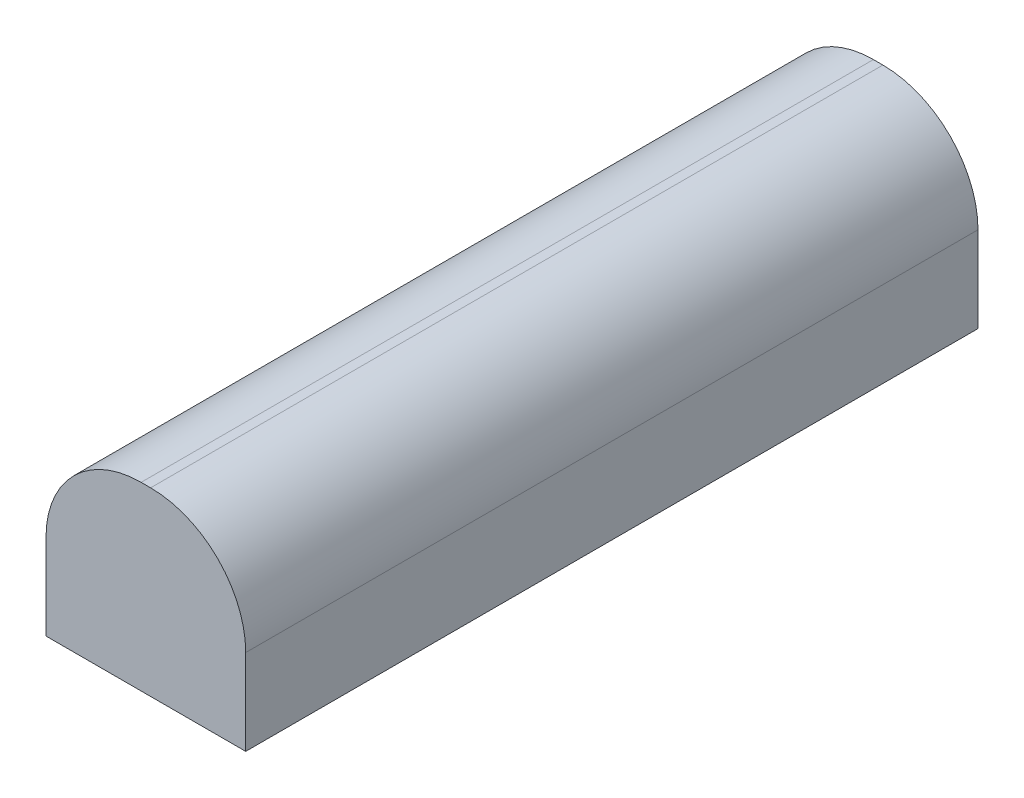
from build123d import *

# Parameters (mm, degrees)
SKETCH1_W           = 21
SKETCH1_H           = 77
BOSS_EXTRUDE1_DEPTH = 19
FILLET1_R           = 10


with BuildPart() as part:
    # Sketch1 → Boss-Extrude1 (new body)
    with BuildSketch(Plane(origin=(0, 0, 0), x_dir=(1, 0, 0), z_dir=(0, 1, 0))):
        with Locations((10.5, 38.5)):
            Rectangle(SKETCH1_W, SKETCH1_H)
    extrude(amount=BOSS_EXTRUDE1_DEPTH)

    # Fillet1
    fillet1_edges = [part.edges().sort_by_distance(p)[0] for p in [
        (21, 19, -38.5),
        (0, 19, -38.5),
    ]]
    fillet(fillet1_edges, radius=FILLET1_R)


solid = part.part
